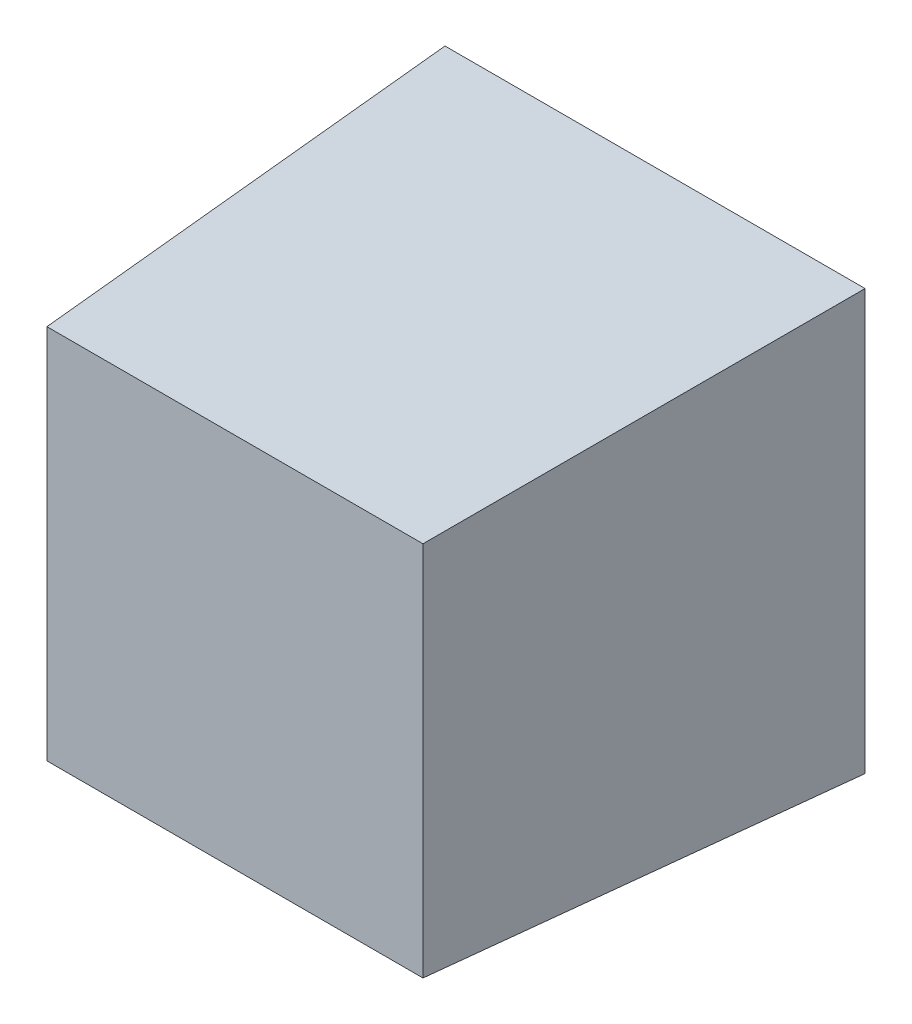
from build123d import *

# Parameters (mm, degrees)
SKETCH_1_W      = 10
SKETCH_1_H      = 10
EXTRUDE_1_DEPTH = 10
EXTRUDE_1_TAPER = 3


with BuildPart() as part:
    # 草图1 → 凸台-拉伸1 (new body)
    with BuildSketch(Plane.XY):
        with Locations((5, 5)):
            Rectangle(SKETCH_1_W, SKETCH_1_H)
    extrude(amount=EXTRUDE_1_DEPTH, taper=EXTRUDE_1_TAPER)


solid = part.part
